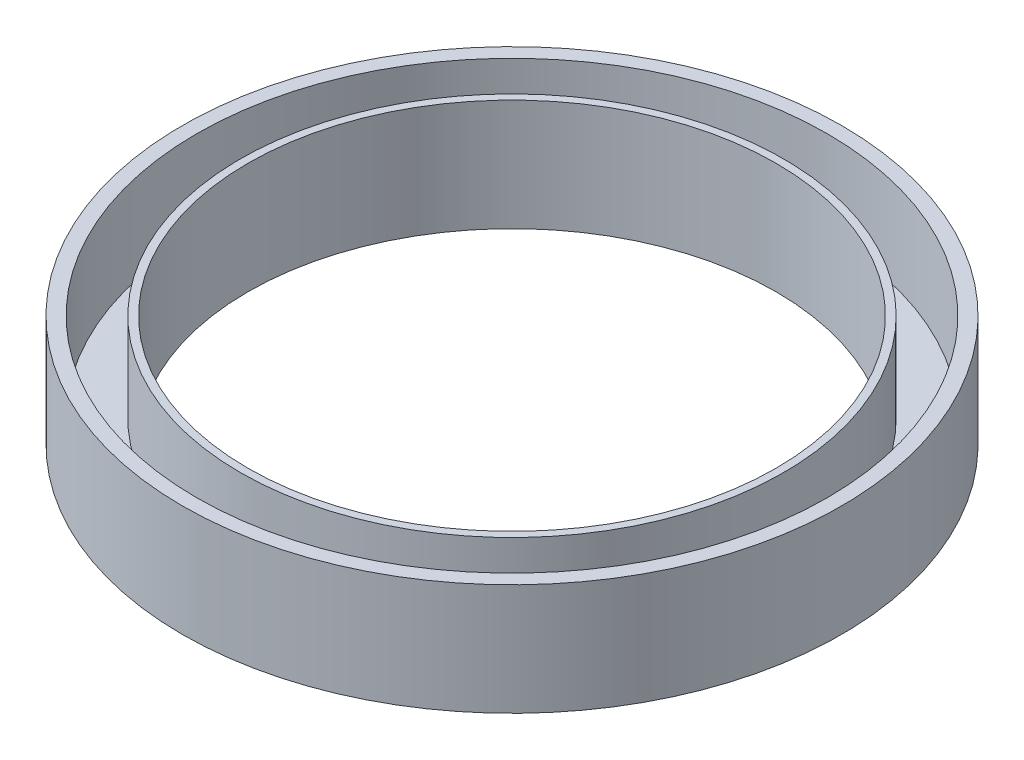
from build123d import *

# Parameters (mm, degrees)
CROQUIS1_R              = 37
CROQUIS1_R_2            = 29.65
SALIENTE_EXTRUIR1_DEPTH = 2.5
CROQUIS2_R              = 37
CROQUIS2_R_2            = 35.4
CROQUIS2_R_3            = 30.5
CROQUIS2_R_4            = 29.65
SALIENTE_EXTRUIR2_DEPTH = 10


with BuildPart() as part:
    # Croquis1 → Saliente-Extruir1 (new body)
    with BuildSketch(Plane(origin=(0, 0, 0), x_dir=(1, 0, 0), z_dir=(0, 1, 0))):
        with Locations(Location((0, 0, 0), (0, 0, 270))):
            Circle(CROQUIS1_R)
        with Locations(Location((0, 0, 0), (0, 0, 270))):
            Circle(CROQUIS1_R_2, mode=Mode.SUBTRACT)
    extrude(amount=SALIENTE_EXTRUIR1_DEPTH)

    # Croquis2 → Saliente-Extruir2 (add)
    # profile 1 of 2: a face of its own
    with BuildSketch(Plane(origin=(0, 2.5, 0), x_dir=(1, 0, 0), z_dir=(0, 1, 0))):
        with Locations(Location((0, 0, 0), (0, 0, 270))):
            Circle(CROQUIS2_R)
        with Locations(Location((0, 0, 0), (0, 0, 270))):
            Circle(CROQUIS2_R_2, mode=Mode.SUBTRACT)
    # profile 2 of 2: a face of its own
    with BuildSketch(Plane(origin=(0, 2.5, 0), x_dir=(1, 0, 0), z_dir=(0, 1, 0))):
        with Locations(Location((0, 0, 0), (0, 0, 270))):
            Circle(CROQUIS2_R_3)
        with Locations(Location((0, 0, 0), (0, 0, 270))):
            Circle(CROQUIS2_R_4, mode=Mode.SUBTRACT)
    extrude(amount=SALIENTE_EXTRUIR2_DEPTH)


solid = part.part
